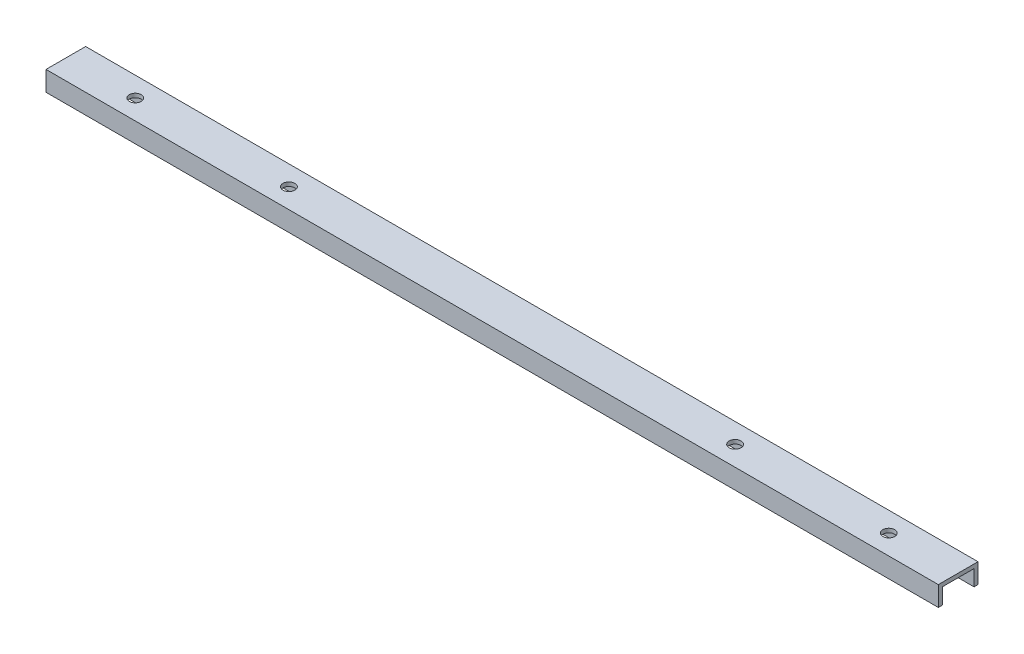
from build123d import *

# Parameters (mm, degrees)
EXTRUDE_1_DEPTH     = 450
SKETCH_2_R          = 3
CUT_EXTRUDE_1_DEPTH = 2


with BuildPart() as part:
    # Эскиз1 → Бобышка-Вытянуть1 (new body)
    with BuildSketch(Plane(origin=(0, 0, 0), x_dir=(0, 0, -1), z_dir=(1, 0, 0))):
        Polygon((-20, 0), (-20, 10), (0, 10), (0, 0), (-2, 0), (-2, 8), (-18, 8), (-18, 0), align=None)
    extrude(amount=EXTRUDE_1_DEPTH)

    # Эскиз2 → Вырез-Вытянуть1 (cut)
    with BuildSketch(Plane(origin=(0, 10, 0), x_dir=(1, 0, 0), z_dir=(0, 1, 0))):
        with Locations(Location((415, -10, 0), (0, 0, 270))):
            Circle(SKETCH_2_R)
        with Locations(Location((337.5, -10, 0), (0, 0, 270))):
            Circle(SKETCH_2_R)
        with Locations(Location((35, -10, 0), (0, 0, 270))):
            Circle(SKETCH_2_R)
        with Locations(Location((112.5, -10, 0), (0, 0, 270))):
            Circle(SKETCH_2_R)
    extrude(amount=-CUT_EXTRUDE_1_DEPTH, mode=Mode.SUBTRACT)


solid = part.part
